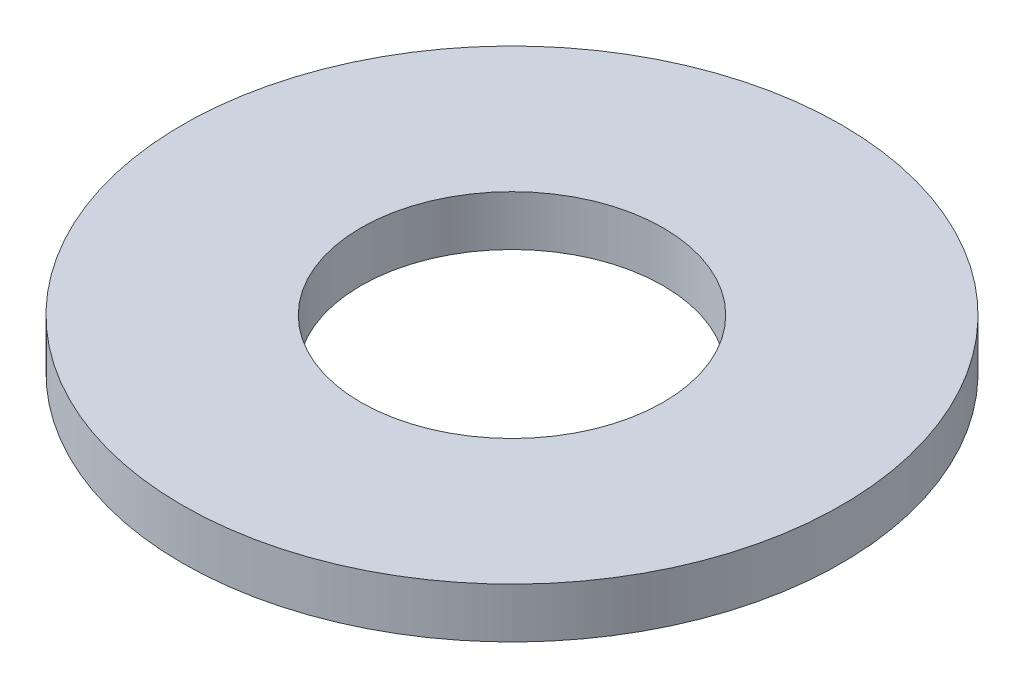
from build123d import *

# Parameters (mm, degrees)
SKETCH1_R           = 9.525
BOSS_EXTRUDE1_DEPTH = 1.4478
SKETCH5_R           = 4.3688
CUT_EXTRUDE1_DEPTH  = 14.547965709


with BuildPart() as part:
    # Sketch1 → Boss-Extrude1 (new body)
    with BuildSketch(Plane(origin=(0, 0, 0), x_dir=(1, 0, 0), z_dir=(0, 1, 0))):
        with Locations(Location((0, 0, 0), (0, 0, 270))):
            Circle(SKETCH1_R)
    extrude(amount=BOSS_EXTRUDE1_DEPTH)

    # Sketch5 → Cut-Extrude1 (cut, through all)
    with BuildSketch(Plane(origin=(0, 1.4478, 0), x_dir=(-1, 0, 0), z_dir=(0, 1, 0))):
        with Locations(Location((0, 0, 0), (0, 0, 90))):
            Circle(SKETCH5_R)
    extrude(amount=-CUT_EXTRUDE1_DEPTH, mode=Mode.SUBTRACT)


solid = part.part
